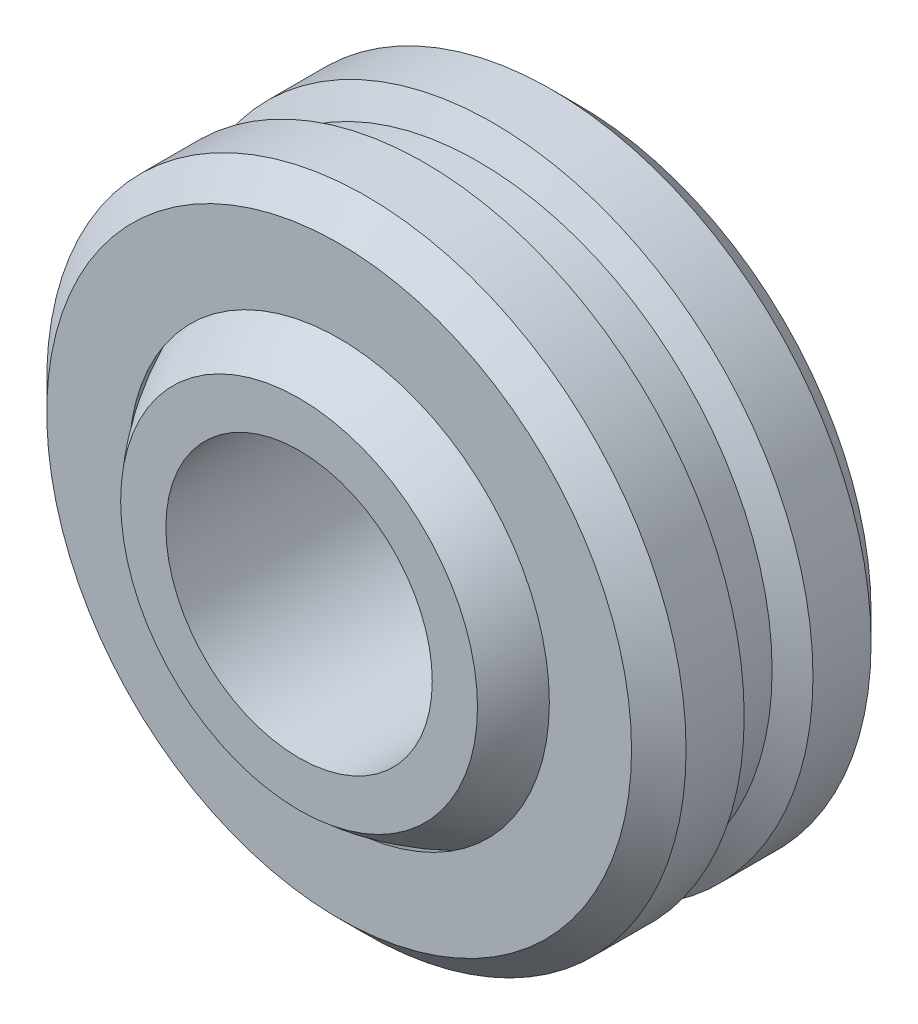
from build123d import *

# Parameters (mm, degrees)
SKETCH1_R               = 9.525
EXTRUDE1_DEPTH          = 3.5687
CUT_EXTRUDE1_DEPTH      = 16.278012717
CUT_EXTRUDE1_DEPTH_BACK = 16.278012717
SKETCH4_R               = 3.96875
CUT_EXTRUDE2_DEPTH      = 16.278012717
CUT_EXTRUDE2_DEPTH_BACK = 16.278012717
SKETCH5_W               = 1.169742594
SKETCH5_H               = 19.05
CHAMFER1_SIZE           = 0.8128


with BuildPart() as part:
    # Sketch1 → Extrude1 (new, symmetric)
    with BuildSketch(Plane.XY):
        Circle(SKETCH1_R)
    extrude(amount=EXTRUDE1_DEPTH, both=True)

    # Sketch2 → Cut-Revolve1 (revolve, cut)
    with BuildSketch(Plane.XY):
        with BuildLine():
            Line((0, 7.208774), (0, -7.208774))
            ThreePointArc((0, -7.208774), (7.208774, 0), (0, 7.208774))
        make_face()
    revolve(axis=Axis((0, 7.208774, 0), (0, 1, 0)), mode=Mode.SUBTRACT)

    # Chamfer1
    chamfer1_edges = [part.edges().sort_by_distance(p)[0] for p in [
        (-9.525, 0, -3.5687),
        (-9.525, 0, 3.5687),
    ]]
    chamfer(chamfer1_edges, length=CHAMFER1_SIZE)

    # Sketch8 → Cut-Revolve2 (revolve, cut)
    with BuildSketch(Plane(origin=(0, 0, 0), x_dir=(0, 0, -1), z_dir=(1, 0, 0)), mode=Mode.PRIVATE) as cut_revolve2_sk:
        Polygon((-1.024814402, 9.525), (-0.5790565, 8.752924667), (0.5790565, 8.752924667), (1.024814402, 9.525), align=None)
    revolve(cut_revolve2_sk.sketch.rotate(Axis((0, 0, 0), (0, 0, -1)), 90), axis=Axis((0, 0, 0), (0, 0, -1)), mode=Mode.SUBTRACT)


with BuildPart() as body_2:
    # Sketch3 → Revolve1 (revolve)
    with BuildSketch(Plane.XY):
        with BuildLine():
            Line((0, 7.1374), (0, -7.1374))
            ThreePointArc((0, -7.1374), (7.1374, 0), (0, 7.1374))
        make_face()
    revolve(axis=Axis((0, 7.1374, 0), (0, 1, 0)))

    # Sketch4 → Cut-Extrude1 (cut, two sides: drawn at the far end of the back side and taken through both)
    with BuildSketch(Plane.XY.offset(-CUT_EXTRUDE1_DEPTH_BACK)):
        with Locations(Location((0, 0, 0), (0, 0, 180))):
            Circle(SKETCH4_R)
    extrude(amount=CUT_EXTRUDE1_DEPTH + CUT_EXTRUDE1_DEPTH_BACK, mode=Mode.SUBTRACT)

    # Sketch5 → Cut-Extrude2 (cut, two sides: drawn at the far end of the back side and taken through both)
    with BuildSketch(Plane(origin=(0, 0, 0), x_dir=(0, 0, -1), z_dir=(1, 0, 0)).offset(-CUT_EXTRUDE2_DEPTH_BACK)):
        with Locations((-5.347371297, 0)):
            Rectangle(SKETCH5_W, SKETCH5_H)
        with Locations((5.347371297, 0)):
            Rectangle(SKETCH5_W, SKETCH5_H)
    extrude(amount=CUT_EXTRUDE2_DEPTH + CUT_EXTRUDE2_DEPTH_BACK, mode=Mode.SUBTRACT)


solid = Compound([part.part, body_2.part])
